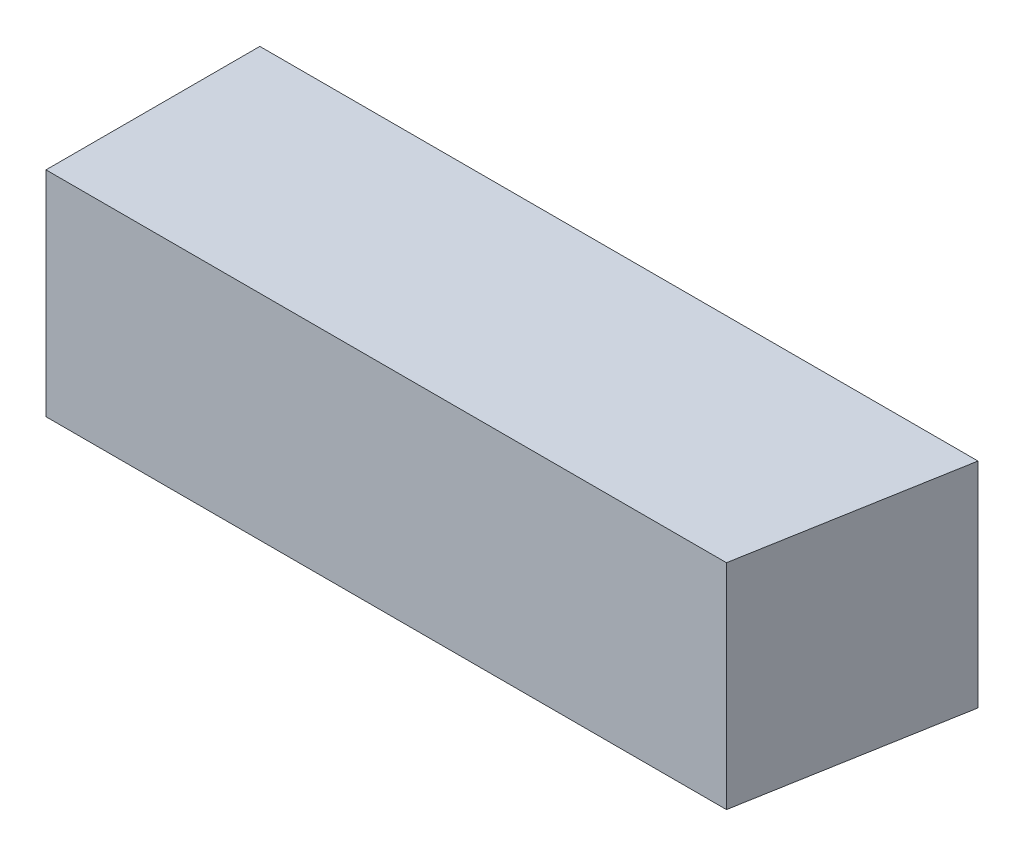
from build123d import *

# Parameters (mm, degrees)
SKETCH1_W           = 88.9
SKETCH1_H           = 88.9
BOSS_EXTRUDE1_DEPTH = 298.577
CUT_EXTRUDE1_DEPTH  = 88.9


with BuildPart() as part:
    # Sketch1 → Boss-Extrude1 (new body)
    with BuildSketch(Plane.YZ):
        with Locations((44.45, 44.45)):
            Rectangle(SKETCH1_W, SKETCH1_H)
    extrude(amount=BOSS_EXTRUDE1_DEPTH)

    # Sketch2 → Cut-Extrude1 (cut)
    with BuildSketch(Plane(origin=(0, 0, 0), x_dir=(-1, 0, 0), z_dir=(0, 1, 0))):
        Polygon((-298.577, 0), (-282.90393, 88.9), (-298.577, 88.9), align=None)
    extrude(amount=CUT_EXTRUDE1_DEPTH, mode=Mode.SUBTRACT)


solid = part.part
